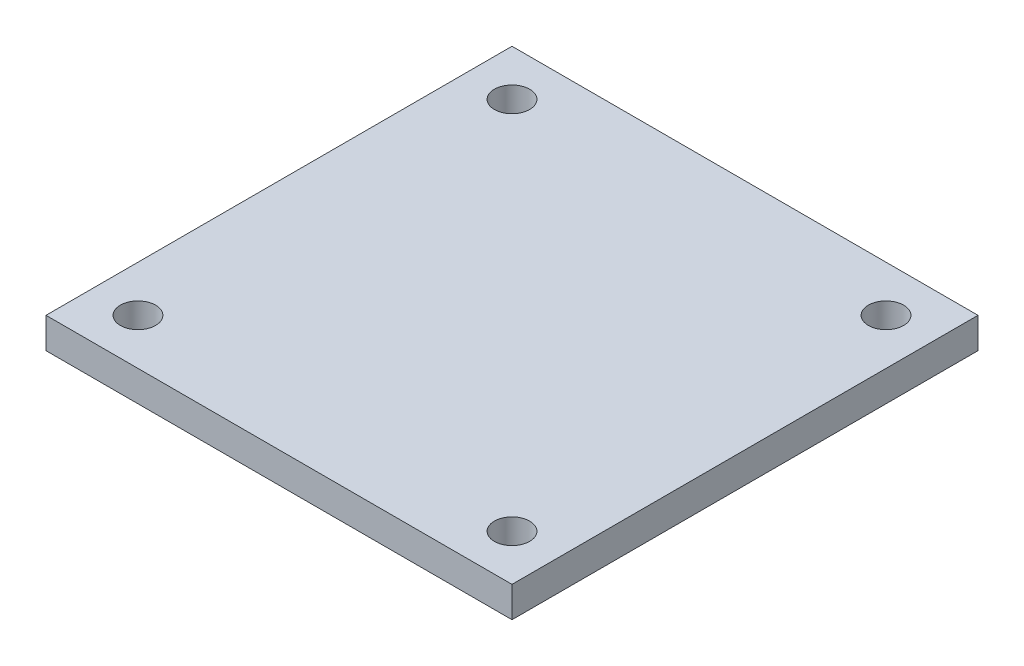
from build123d import *

# Parameters (mm, degrees)
SKETCH1_W           = 30.4
SKETCH1_H           = 30.4
SKETCH1_R           = 1.15
BOSS_EXTRUDE1_DEPTH = 2


with BuildPart() as part:
    # Sketch1 → Boss-Extrude1 (new body)
    with BuildSketch(Plane(origin=(0, 0, 0), x_dir=(1, 0, 0), z_dir=(0, 1, 0))):
        Rectangle(SKETCH1_W, SKETCH1_H)
        with Locations(Location((-12.2, 12.2, 0), (0, 0, 270))):
            Circle(SKETCH1_R, mode=Mode.SUBTRACT)
        with Locations(Location((12.2, 12.2, 0), (0, 0, 90))):
            Circle(SKETCH1_R, mode=Mode.SUBTRACT)
        with Locations(Location((12.2, -12.2, 0), (0, 0, 270))):
            Circle(SKETCH1_R, mode=Mode.SUBTRACT)
        with Locations(Location((-12.2, -12.2, 0), (0, 0, 90))):
            Circle(SKETCH1_R, mode=Mode.SUBTRACT)
    extrude(amount=BOSS_EXTRUDE1_DEPTH)


solid = part.part
